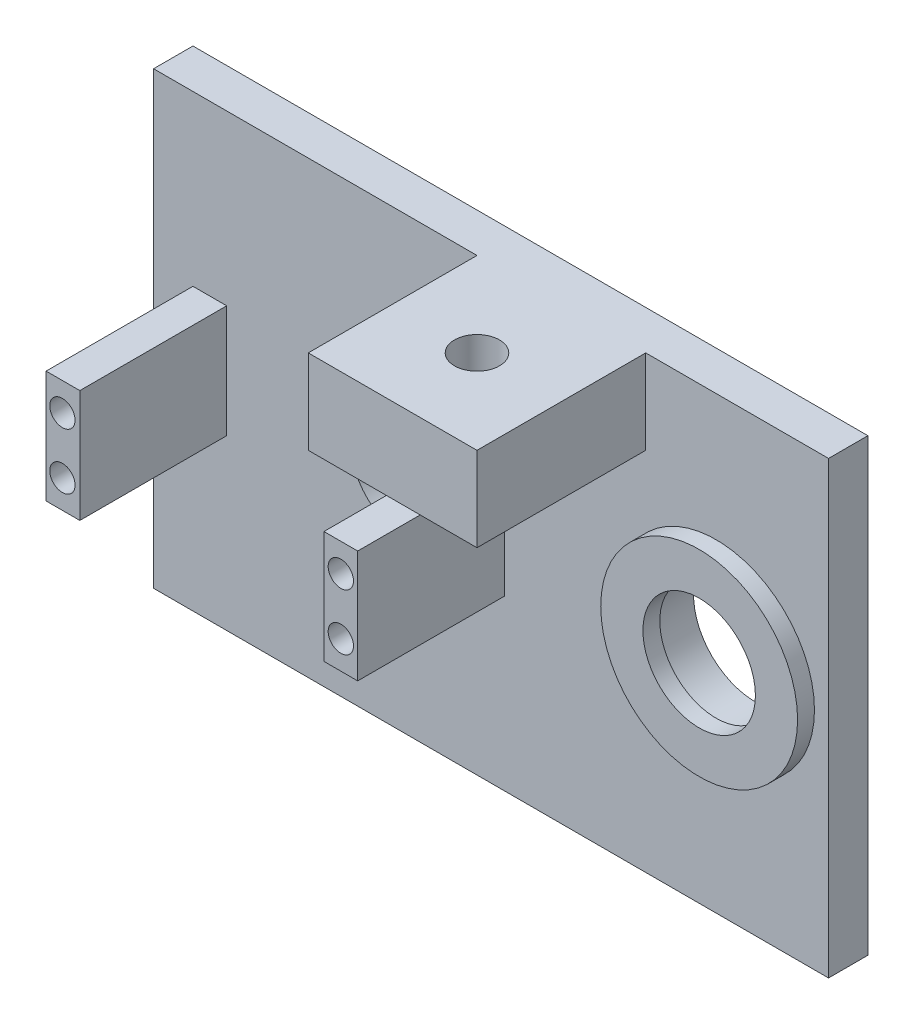
from build123d import *

# Parameters (mm, degrees)
SKETCH1_W           = 120
SKETCH1_H           = 80
SKETCH1_R           = 10
SKETCH1_R_2         = 11
BOSS_EXTRUDE1_DEPTH = 3.5
SKETCH2_R           = 17.5
SKETCH2_R_2         = 10
BOSS_EXTRUDE2_DEPTH = 3
SKETCH3_W           = 6
SKETCH3_H           = 20
SKETCH3_R           = 2.25
BOSS_EXTRUDE3_DEPTH = 26.11
CUT_EXTRUDE1_START  = -26.11
SKETCH4_R           = 2.25
CUT_EXTRUDE1_DEPTH  = 26.11
SKETCH5_W           = 30
SKETCH5_H           = 15
BOSS_EXTRUDE4_DEPTH = 30
SKETCH6_R           = 4
CUT_EXTRUDE2_DEPTH  = 29


with BuildPart() as part:
    # Sketch1 → Boss-Extrude1 (new, symmetric)
    with BuildSketch(Plane.XY):
        Rectangle(SKETCH1_W, SKETCH1_H)
        with Locations((-15, 0)):
            Circle(SKETCH1_R, mode=Mode.SUBTRACT)
        with Locations((40, 0)):
            Circle(SKETCH1_R_2, mode=Mode.SUBTRACT)
    extrude(amount=BOSS_EXTRUDE1_DEPTH, both=True)

    # Sketch2 → Boss-Extrude2 (add)
    with BuildSketch(Plane.XY.offset(3.5)):
        with Locations(Location((40, 0, 0), (0, 0, 180))):
            Circle(SKETCH2_R)
        with Locations((40, 0)):
            Circle(SKETCH2_R_2, mode=Mode.SUBTRACT)
    extrude(amount=BOSS_EXTRUDE2_DEPTH)

    # Sketch3 → Boss-Extrude3 (add)
    # profile 1 of 2: a face of its own
    with BuildSketch(Plane.XY.offset(3.5)):
        with Locations((-50, 0)):
            Rectangle(SKETCH3_W, SKETCH3_H)
        with Locations(Location((-50.1, -5, 0), (0, 0, 180))):
            Circle(SKETCH3_R, mode=Mode.SUBTRACT)
        with Locations(Location((-50.1, 5, 0), (0, 0, 180))):
            Circle(SKETCH3_R, mode=Mode.SUBTRACT)
    # profile 2 of 2: a face of its own
    with BuildSketch(Plane.XY.offset(3.5)):
        with Locations((-0.6, 0)):
            Rectangle(SKETCH3_W, SKETCH3_H)
        with Locations(Location((-0.6, -5, 0), (0, 0, 180))):
            Circle(SKETCH3_R, mode=Mode.SUBTRACT)
        with Locations(Location((-0.6, 5, 0), (0, 0, 180))):
            Circle(SKETCH3_R, mode=Mode.SUBTRACT)
    extrude(amount=BOSS_EXTRUDE3_DEPTH)

    # Sketch4 → Cut-Extrude1 (cut)
    with BuildSketch(Plane.XY.offset(3.5).offset(CUT_EXTRUDE1_START)):
        with Locations(Location((-50.1, 5, 0), (0, 0, 180))):
            Circle(SKETCH4_R)
        with Locations(Location((-50.1, -5, 0), (0, 0, 180))):
            Circle(SKETCH4_R)
        with Locations(Location((-0.6, 5, 0), (0, 0, 180))):
            Circle(SKETCH4_R)
        with Locations(Location((-0.6, -5, 0), (0, 0, 180))):
            Circle(SKETCH4_R)
    extrude(amount=CUT_EXTRUDE1_DEPTH, mode=Mode.SUBTRACT)

    # Sketch5 → Boss-Extrude4 (add)
    with BuildSketch(Plane.XY.offset(3.5)):
        with Locations((12.5, 32.5)):
            Rectangle(SKETCH5_W, SKETCH5_H)
    extrude(amount=BOSS_EXTRUDE4_DEPTH)

    # Sketch6 → Cut-Extrude2 (cut)
    with BuildSketch(Plane(origin=(0, 40, 0), x_dir=(1, 0, 0), z_dir=(0, 1, 0))):
        with Locations(Location((12.5, -18.5, 0), (0, 0, 270))):
            Circle(SKETCH6_R)
    extrude(amount=-CUT_EXTRUDE2_DEPTH, mode=Mode.SUBTRACT)


solid = part.part
